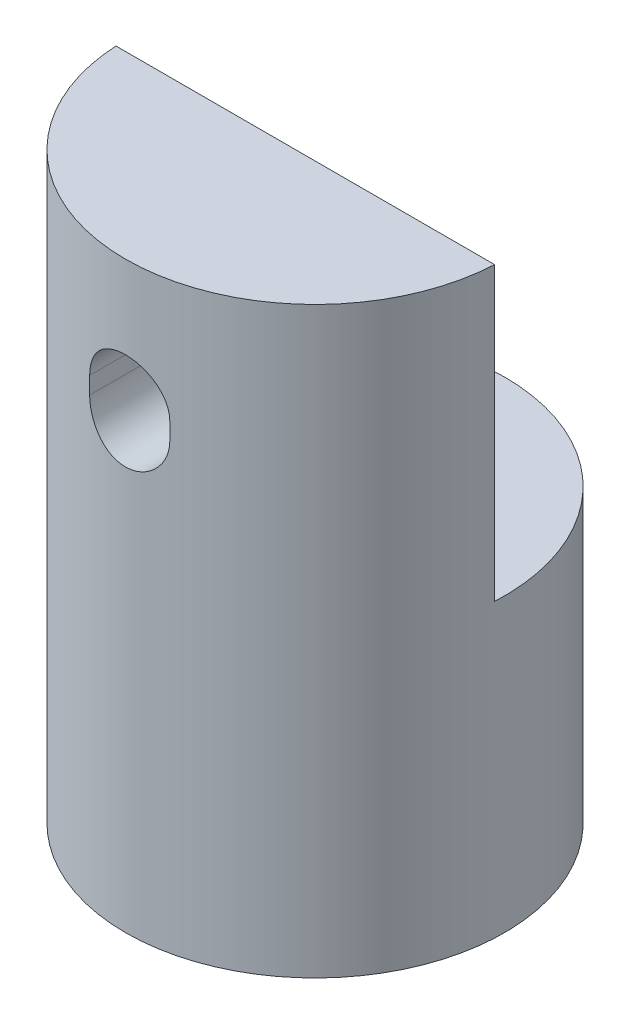
from build123d import *

# Parameters (mm, degrees)
SKETCH1_R               = 9.75
BOSS_EXTRUDE1_DEPTH     = 30
CUT_EXTRUDE1_DEPTH      = 0.5
CUT_EXTRUDE1_DEPTH_BACK = 30
SKETCH3_W               = 19.5
SKETCH3_H               = 15
CUT_EXTRUDE2_DEPTH      = 30


with BuildPart() as part:
    # Sketch1 → Boss-Extrude1 (new body)
    with BuildSketch(Plane(origin=(0, 0, 0), x_dir=(1, 0, 0), z_dir=(0, 1, 0))):
        with Locations(Location((0, 0, 0), (0, 0, 270))):
            Circle(SKETCH1_R)
    extrude(amount=BOSS_EXTRUDE1_DEPTH)

    # Sketch3 → Cut-Extrude1 (cut, two sides: drawn at the far end of the back side and taken through both)
    with BuildSketch(Plane.XY.offset(-CUT_EXTRUDE1_DEPTH_BACK)):
        with Locations((0, 22.5)):
            Rectangle(SKETCH3_W, SKETCH3_H)
    extrude(amount=CUT_EXTRUDE1_DEPTH + CUT_EXTRUDE1_DEPTH_BACK, mode=Mode.SUBTRACT)

    # Sketch4 → Cut-Extrude2 (cut)
    with BuildSketch(Plane(origin=(0, 0, 0.5), x_dir=(-1, 0, 0), z_dir=(0, 0, -1))):
        with BuildLine():
            Line((2.06, 23.683843632), (2.06, 22.803843632))
            ThreePointArc((2.06, 22.803843632), (0, 20.743843632), (-2.06, 22.803843632))
            Line((-2.06, 22.803843632), (-2.06, 23.683843632))
            ThreePointArc((-2.06, 23.683843632), (0, 25.743843632), (2.06, 23.683843632))
        make_face()
    extrude(amount=-CUT_EXTRUDE2_DEPTH, mode=Mode.SUBTRACT)


solid = part.part
